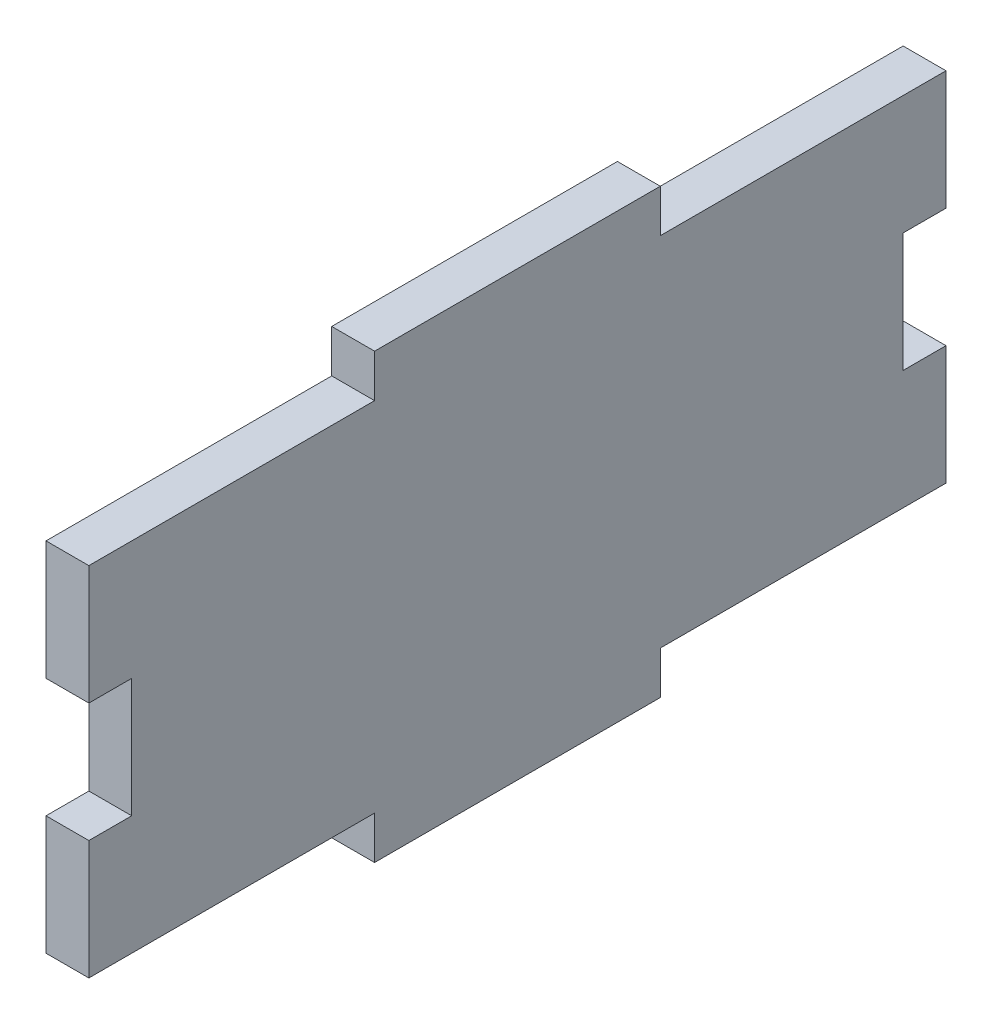
from build123d import *

# Parameters (mm, degrees)
SIDES_EXTRUDED_DEPTH = 3


with BuildPart() as part:
    # Sides → Sides Extruded (new body)
    with BuildSketch(Plane(origin=(0, 0, 0), x_dir=(0, 0, -1), z_dir=(1, 0, 0))):
        Polygon((0, 16.66666666), (0, 25), (20, 25), (20, 28), (40, 28), (40, 25), (60, 25), (60, 16.66666666), (57, 16.66666666), (57, 8.33333333), (60, 8.33333333), (60, 0), (40, 0), (40, -3), (20, -3), (20, 0), (0, 0), (0, 8.33333333), (3, 8.33333333), (3, 16.66666666), align=None)
    extrude(amount=SIDES_EXTRUDED_DEPTH)


solid = part.part
